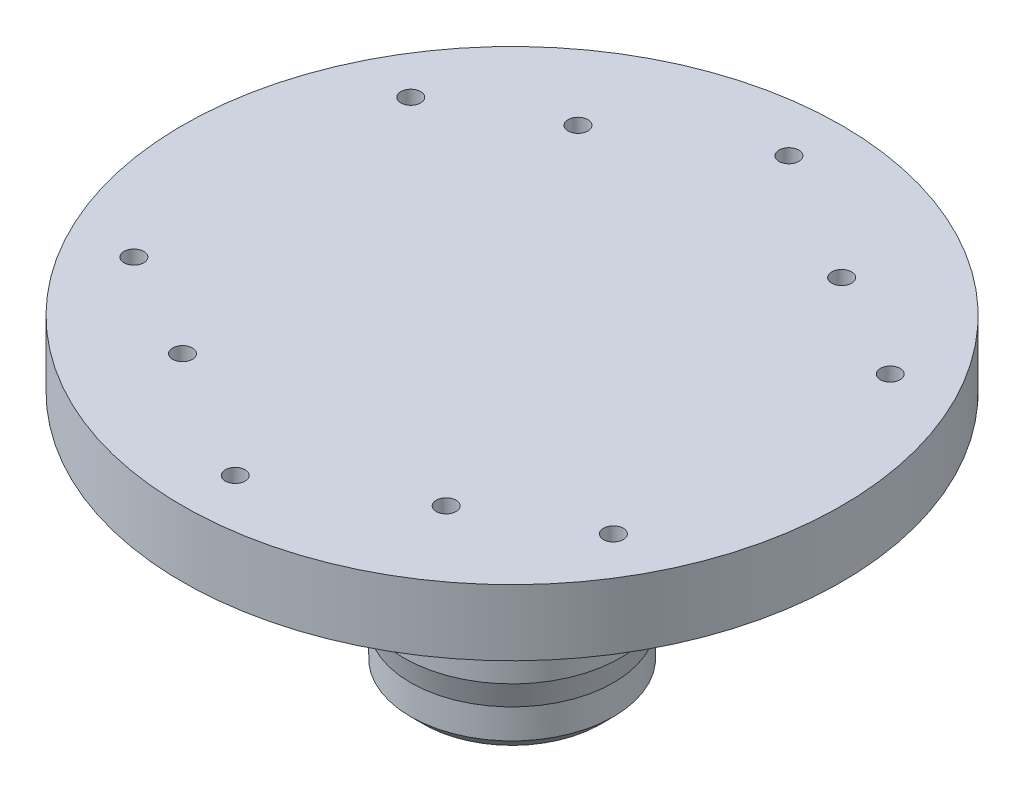
from build123d import *

# Parameters (mm, degrees)
SKETCH5_R          = 0.75
CUT_EXTRUDE1_DEPTH = 43.452915094
CIRPATTERN2_COUNT  = 6
SKETCH6_R          = 0.75
CUT_EXTRUDE2_DEPTH = 43.452915094
SKETCH7_R          = 2.6
CUT_EXTRUDE3_DEPTH = 4
CHAMFER1_SIZE      = 0.5
CHAMFER2_SIZE      = 1


with BuildPart() as part:
    # Sketch1 → Revolve1 (revolve)
    with BuildSketch(Plane.XY, mode=Mode.PRIVATE) as revolve1_sk:
        Polygon((10.2, 18.5), (10.2, 14.5), (8.2, 14.5), (8.2, 0), (0, 0), (0, 23.5), (25, 23.5), (25, 18.5), align=None)
    revolve(revolve1_sk.sketch.rotate(Axis((0, 0, 0), (0, 1, 0)), 90), axis=Axis((0, 0, 0), (0, 1, 0)))

    # Sketch5 → Cut-Extrude1 (cut, through all)
    with BuildSketch(Plane(origin=(0, 23.5, 0), x_dir=(1, 0, 0), z_dir=(0, 1, 0))):
        with Locations(Location((0, 21, 0), (0, 0, 270))):
            Circle(SKETCH5_R)
    cut_extrude1 = extrude(amount=-CUT_EXTRUDE1_DEPTH, mode=Mode.SUBTRACT)

    # CirPattern2: Cut-Extrude1 ×6 about axis
    cirpattern2_axis = Axis((0, 0, 0), (0, 1, 0))
    for i in range(1, CIRPATTERN2_COUNT):
        add(cut_extrude1.rotate(cirpattern2_axis, i * 360 / CIRPATTERN2_COUNT), mode=Mode.SUBTRACT)

    # Sketch6 → Cut-Extrude2 (cut, through all)
    with BuildSketch(Plane(origin=(0, 23.5, 0), x_dir=(1, 0, 0), z_dir=(0, 1, 0))):
        with Locations(Location((-10, 15, 0), (0, 0, 270))):
            Circle(SKETCH6_R)
        with Locations(Location((10, 15, 0), (0, 0, 270))):
            Circle(SKETCH6_R)
        with Locations(Location((-10, -15, 0), (0, 0, 270))):
            Circle(SKETCH6_R)
        with Locations(Location((10, -15, 0), (0, 0, 270))):
            Circle(SKETCH6_R)
    extrude(amount=-CUT_EXTRUDE2_DEPTH, mode=Mode.SUBTRACT)

    # Sketch7 → Cut-Extrude3 (cut)
    with BuildSketch(Plane.XZ):
        with Locations(Location((0, 0, 0), (0, 0, 270))):
            Circle(SKETCH7_R)
    extrude(amount=-CUT_EXTRUDE3_DEPTH, mode=Mode.SUBTRACT)

    # Sketch8 → Cut-Revolve1 (revolve, cut)
    with BuildSketch(Plane.XY, mode=Mode.PRIVATE) as cut_revolve1_sk:
        Polygon((-8.2, 5.1), (-7.7, 3.233974596), (-7.7, 0), (-8.2, 0), align=None)
    revolve(cut_revolve1_sk.sketch.rotate(Axis((0, 14.5, 0), (0, -1, 0)), 270), axis=Axis((0, 14.5, 0), (0, -1, 0)), mode=Mode.SUBTRACT)

    # Chamfer1
    chamfer1_edges = [part.edges().sort_by_distance(p)[0] for p in [
        (0, 0, 2.6),
    ]]
    chamfer(chamfer1_edges, length=CHAMFER1_SIZE)

    # Chamfer2
    chamfer2_edges = [part.edges().sort_by_distance(p)[0] for p in [
        (0, 0, -7.7),
    ]]
    chamfer(chamfer2_edges, length=CHAMFER2_SIZE)


solid = part.part
